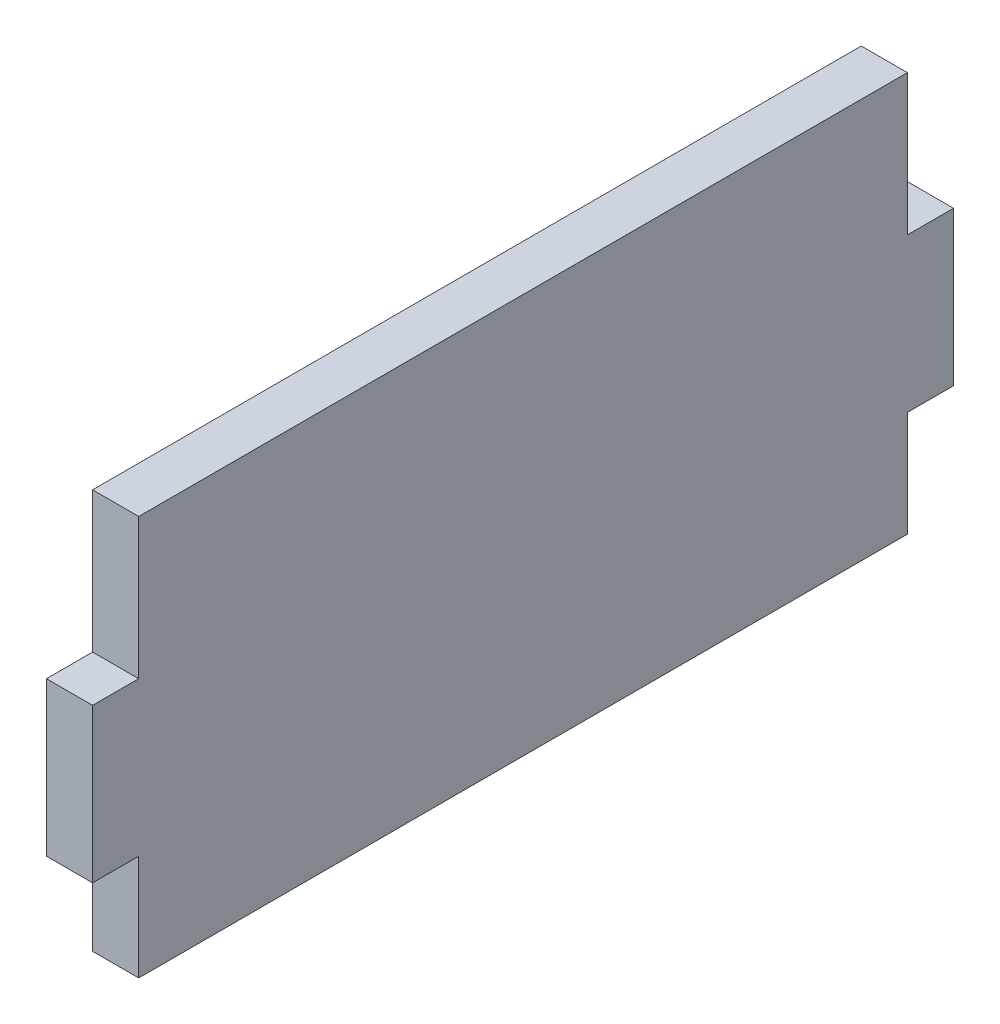
from build123d import *

# Parameters (mm, degrees)
BOSS_EXTRUDE1_DEPTH = 3


with BuildPart() as part:
    # Sketch1 → Boss-Extrude1 (new body)
    with BuildSketch(Plane(origin=(0, 0, 0), x_dir=(0, 0, -1), z_dir=(1, 0, 0))):
        Polygon((0, 0), (50, 0), (50, 6.86), (53, 6.86), (53, 16.86), (50, 16.86), (50, 26), (0, 26), (0, 16.86), (-3, 16.86), (-3, 6.86), (0, 6.86), align=None)
    extrude(amount=BOSS_EXTRUDE1_DEPTH)


solid = part.part
